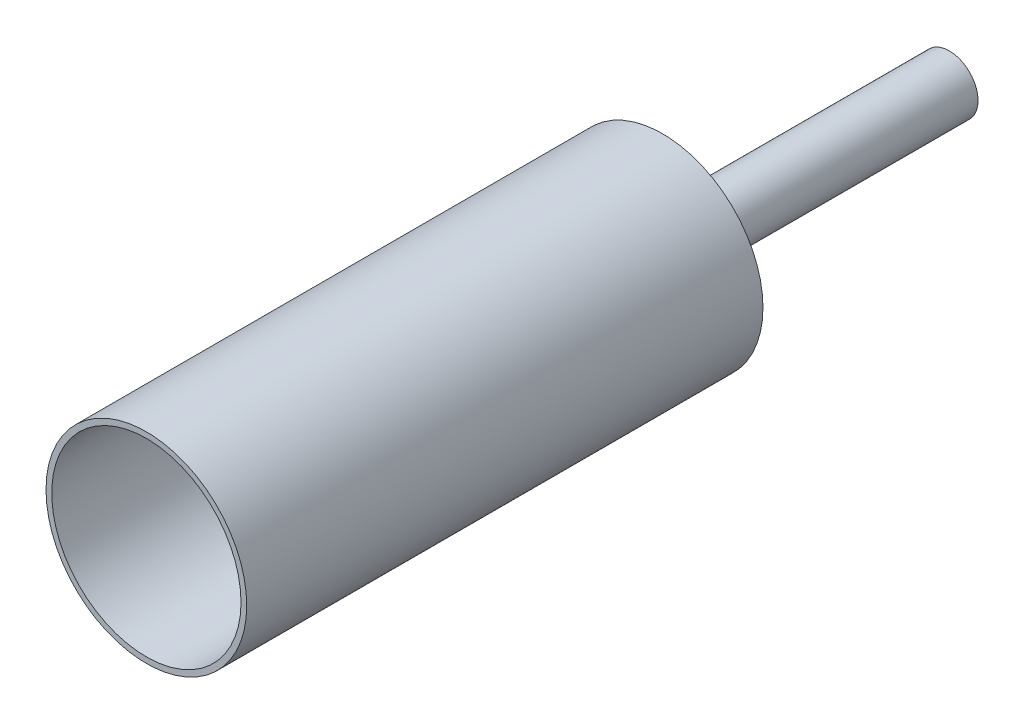
from build123d import *

# Parameters (mm, degrees)
SCHIZZO1_R                   = 17.5
ESTRUSIONE_ESTRUSIONE1_DEPTH = 90
SCHIZZO2_R                   = 16.5
TAGLIO_ESTRUSIONE1_DEPTH     = 88
SCHIZZO3_R                   = 5
ESTRUSIONE_ESTRUSIONE2_DEPTH = 50


with BuildPart() as part:
    # Schizzo1 → Estrusione-Estrusione1 (new body)
    with BuildSketch(Plane.XY):
        with Locations(Location((0, 0, 0), (0, 0, 180))):
            Circle(SCHIZZO1_R)
    extrude(amount=ESTRUSIONE_ESTRUSIONE1_DEPTH)

    # Schizzo2 → Taglio-Estrusione1 (cut)
    with BuildSketch(Plane.XY.offset(90)):
        Circle(SCHIZZO2_R)
    extrude(amount=-TAGLIO_ESTRUSIONE1_DEPTH, mode=Mode.SUBTRACT)

    # Schizzo3 → Estrusione-Estrusione2 (add)
    with BuildSketch(Plane(origin=(0, 0, 0), x_dir=(-1, 0, 0), z_dir=(0, 0, -1))):
        Circle(SCHIZZO3_R)
    extrude(amount=ESTRUSIONE_ESTRUSIONE2_DEPTH)


solid = part.part
